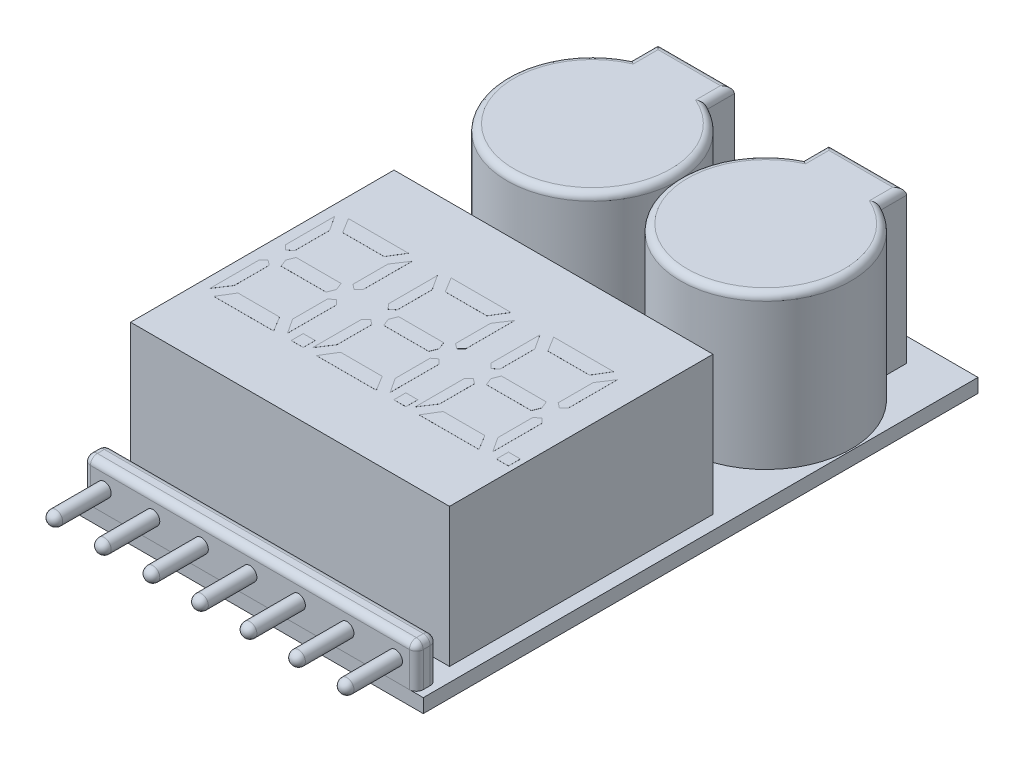
from build123d import *

# Parameters (mm, degrees)
IZIM1_W                  = 25
IZIM1_H                  = 40
EXTRUDED_BOSS_DEPTH      = 1
IZIM2_W                  = 24
IZIM2_H                  = 1.5
PIN_HEADER_DEPTH         = 3
IZIM3_R                  = 0.5
PINS_DEPTH               = 4
IZIM4_W                  = 23
IZIM4_H                  = 19
DISPLAY_DEPTH            = 10
BUZZER_DEPTH             = 11
FILLET_1_R               = 0.5
FILLET_2_R               = 0.5
DISPLAY_NUMBERS_DEPTH    = 0.005
DISPLAY_NUMBERS_2_DEPTH  = 0.005
DISPLAY_NUMBERS_3_DEPTH  = 0.005
IZIM8_W                  = 0.864
IZIM8_H                  = 0.864
DISPLAY_NUMBERS_4_DEPTH  = 0.005
DISPLAY_NUMBERS_5_DEPTH  = 0.005
DISPLAY_NUMBERS_6_DEPTH  = 0.005
DISPLAY_NUMBERS_7_DEPTH  = 0.005
DISPLAY_NUMBERS_8_DEPTH  = 0.005
DISPLAY_NUMBERS_9_DEPTH  = 0.005
DISPLAY_NUMBERS_10_DEPTH = 0.005
DISPLAY_NUMBERS_11_DEPTH = 0.005
DISPLAY_NUMBERS_12_DEPTH = 0.005
DISPLAY_NUMBERS_13_DEPTH = 0.005
DISPLAY_NUMBERS_14_DEPTH = 0.005
DISPLAY_NUMBERS_15_DEPTH = 0.005
DISPLAY_NUMBERS_16_DEPTH = 0.005
DISPLAY_NUMBERS_17_DEPTH = 0.005
DISPLAY_NUMBERS_18_DEPTH = 0.005
DISPLAY_NUMBERS_19_DEPTH = 0.005
DISPLAY_NUMBERS_20_DEPTH = 0.005
DISPLAY_NUMBERS_21_DEPTH = 0.005
DISPLAY_NUMBERS_22_DEPTH = 0.005
DISPLAY_NUMBERS_23_DEPTH = 0.005
DISPLAY_NUMBERS_24_DEPTH = 0.005
FILLET_3_R               = 0.5


with BuildPart() as part:
    # Çizim1 → extruded boss (new body)
    with BuildSketch(Plane(origin=(0, 0, 0), x_dir=(1, 0, 0), z_dir=(0, 1, 0))):
        Rectangle(IZIM1_W, IZIM1_H)
    extrude(amount=EXTRUDED_BOSS_DEPTH)

    # Çizim4 → display (add)
    with BuildSketch(Plane(origin=(0, 1, 0), x_dir=(1, 0, 0), z_dir=(0, 1, 0))):
        with Locations((0, -7.609299333)):
            Rectangle(IZIM4_W, IZIM4_H)
    extrude(amount=DISPLAY_DEPTH)

    # Çizim5 → buzzer (add)
    with BuildSketch(Plane(origin=(0, 1, 0), x_dir=(1, 0, 0), z_dir=(0, 1, 0))):
        with BuildLine():
            Line((3.448250256, 16.427727605), (3.448250256, 18.297718207))
            Line((3.448250256, 18.297718207), (9.051749744, 18.297718207))
            Line((9.051749744, 18.297718207), (9.051749744, 16.427727605))
            ThreePointArc((9.051749744, 16.427727605), (6.25, 4.788544167), (3.448250256, 16.427727605))
        make_face()
        with BuildLine():
            Line((-9, 16.453867572), (-9, 18.427827016))
            Line((-9, 18.427827016), (-3.5, 18.427827016))
            Line((-3.5, 18.427827016), (-3.5, 16.453867572))
            ThreePointArc((-3.5, 16.453867572), (-6.25, 4.788544167), (-9, 16.453867572))
        make_face()
    extrude(amount=BUZZER_DEPTH)

    # fillet 2
    fillet_2_edges = [part.edges().sort_by_distance(p)[0] for p in [
        (6.25, 12, -4.788544167),
        (9.051749744, 12, -17.362722906),
        (6.25, 12, -18.297718207),
        (3.448250256, 12, -17.362722906),
        (-6.25, 12, -4.788544167),
        (-3.5, 12, -17.440847294),
        (-6.25, 12, -18.427827016),
        (-9, 12, -17.440847294),
    ]]
    fillet(fillet_2_edges, radius=FILLET_2_R)


with BuildPart() as body_2:
    # Çizim2 → pin header (new body)
    with BuildSketch(Plane(origin=(0, 1, 0), x_dir=(1, 0, 0), z_dir=(0, 1, 0))):
        with Locations((0, -19.25)):
            Rectangle(IZIM2_W, IZIM2_H)
    extrude(amount=PIN_HEADER_DEPTH)

    # Çizim3 → pins (add)
    with BuildSketch(Plane.XY.offset(20)):
        with Locations(Location((0, 2.5, 0), (0, 0, 180))):
            Circle(IZIM3_R)
        with Locations(Location((3.5, 2.5, 0), (0, 0, 180))):
            Circle(IZIM3_R)
        with Locations(Location((7, 2.5, 0), (0, 0, 180))):
            Circle(IZIM3_R)
        with Locations(Location((10.5, 2.5, 0), (0, 0, 180))):
            Circle(IZIM3_R)
        with Locations(Location((-3.5, 2.5, 0), (0, 0, 180))):
            Circle(IZIM3_R)
        with Locations(Location((-7, 2.5, 0), (0, 0, 180))):
            Circle(IZIM3_R)
        with Locations(Location((-10.5, 2.5, 0), (0, 0, 180))):
            Circle(IZIM3_R)
    extrude(amount=PINS_DEPTH)

    # fillet 1
    fillet_1_edges = [body_2.edges().sort_by_distance(p)[0] for p in [
        (12, 4, 19.25),
        (0, 4, 18.5),
        (-12, 4, 19.25),
        (0, 4, 20),
        (-12, 2.5, 18.5),
        (12, 2.5, 18.5),
        (12, 2.5, 20),
        (-12, 2.5, 20),
    ]]
    fillet(fillet_1_edges, radius=FILLET_1_R)

    # fillet 3
    fillet_3_edges = [body_2.edges().sort_by_distance(p)[0] for p in [
        (0.5, 2.5, 24),
        (4, 2.5, 24),
        (7.5, 2.5, 24),
        (11, 2.5, 24),
        (-3, 2.5, 24),
        (-6.5, 2.5, 24),
        (-10, 2.5, 24),
    ]]
    fillet(fillet_3_edges, radius=FILLET_3_R)


with BuildPart() as body_3:
    # Çizim8 → display numbers (new body)
    with BuildSketch(Plane(origin=(0, 11, 0), x_dir=(1, 0, 0), z_dir=(0, 1, 0))):
        Polygon((-9.565923628, -7.102635228), (-6.325923628, -7.102635228), (-6.111966697, -7.642635228), (-6.325923628, -8.182635228), (-9.565923628, -8.182635228), (-9.77988056, -7.642635228), align=None)
    extrude(amount=DISPLAY_NUMBERS_DEPTH)


with BuildPart() as body_4:
    # Çizim8 → display numbers 2 (new body)
    with BuildSketch(Plane(origin=(0, 11, 0), x_dir=(1, 0, 0), z_dir=(0, 1, 0))):
        Polygon((-6.446228557, -11.4174762), (-9.445618699, -11.4174762), (-10.105923628, -12.4974762), (-5.785923628, -12.4974762), align=None)
    extrude(amount=DISPLAY_NUMBERS_2_DEPTH)


with BuildPart() as body_5:
    # Çizim8 → display numbers 3 (new body)
    with BuildSketch(Plane(origin=(0, 11, 0), x_dir=(1, 0, 0), z_dir=(0, 1, 0))):
        Polygon((-10.04799547, -11.079556724), (-10.742963358, -12.137584244), (-10.742963358, -8.607452765), (-10.417746487, -8.274597516), (-10.04799547, -8.558654673), align=None)
    extrude(amount=DISPLAY_NUMBERS_3_DEPTH)


with BuildPart() as body_6:
    # Çizim8 → display numbers 4 (new body)
    with BuildSketch(Plane(origin=(0, 11, 0), x_dir=(1, 0, 0), z_dir=(0, 1, 0))):
        with Locations((-4.127020396, -12.031325599)):
            Rectangle(IZIM8_W, IZIM8_H)
    extrude(amount=DISPLAY_NUMBERS_4_DEPTH)


with BuildPart() as body_7:
    # Çizim8 → display numbers 5 (new body)
    with BuildSketch(Plane(origin=(0, 11, 0), x_dir=(1, 0, 0), z_dir=(0, 1, 0))):
        Polygon((-5.47410077, -8.274597516), (-5.843851787, -8.558654673), (-5.843851787, -11.079556724), (-5.148883899, -12.137584244), (-5.148883899, -8.607452765), align=None)
    extrude(amount=DISPLAY_NUMBERS_5_DEPTH)


with BuildPart() as body_8:
    # Çizim8 → display numbers 6 (new body)
    with BuildSketch(Plane(origin=(0, 11, 0), x_dir=(1, 0, 0), z_dir=(0, 1, 0))):
        Polygon((-2.705923628, -12.4974762), (1.614076372, -12.4974762), (0.953771443, -11.4174762), (-2.045618699, -11.4174762), align=None)
    extrude(amount=DISPLAY_NUMBERS_6_DEPTH)


with BuildPart() as body_9:
    # Çizim8 → display numbers 7 (new body)
    with BuildSketch(Plane(origin=(0, 11, 0), x_dir=(1, 0, 0), z_dir=(0, 1, 0))):
        Polygon((-5.785923628, -2.787794256), (-10.105923628, -2.787794256), (-9.445618699, -3.867794256), (-6.446228557, -3.867794256), align=None)
    extrude(amount=DISPLAY_NUMBERS_7_DEPTH)


with BuildPart() as body_10:
    # Çizim8 → display numbers 8 (new body)
    with BuildSketch(Plane(origin=(0, 11, 0), x_dir=(1, 0, 0), z_dir=(0, 1, 0))):
        Polygon((4.694076372, -12.4974762), (9.014076372, -12.4974762), (8.353771443, -11.4174762), (5.354381301, -11.4174762), align=None)
    extrude(amount=DISPLAY_NUMBERS_8_DEPTH)


with BuildPart() as body_11:
    # Çizim8 → display numbers 9 (new body)
    with BuildSketch(Plane(origin=(0, 11, 0), x_dir=(1, 0, 0), z_dir=(0, 1, 0))):
        Polygon((-5.843851787, -4.205713732), (-5.148883899, -3.147686212), (-5.148883899, -6.677817691), (-5.47410077, -7.01067294), (-5.843851787, -6.726615783), align=None)
    extrude(amount=DISPLAY_NUMBERS_9_DEPTH)


with BuildPart() as body_12:
    # Çizim8 → display numbers 10 (new body)
    with BuildSketch(Plane(origin=(0, 11, 0), x_dir=(1, 0, 0), z_dir=(0, 1, 0))):
        Polygon((5.234076372, -8.182635228), (8.474076372, -8.182635228), (8.688033303, -7.642635228), (8.474076372, -7.102635228), (5.234076372, -7.102635228), (5.02011944, -7.642635228), align=None)
    extrude(amount=DISPLAY_NUMBERS_10_DEPTH)


with BuildPart() as body_13:
    # Çizim8 → display numbers 11 (new body)
    with BuildSketch(Plane(origin=(0, 11, 0), x_dir=(1, 0, 0), z_dir=(0, 1, 0))):
        Polygon((-10.417746487, -7.01067294), (-10.04799547, -6.726615783), (-10.04799547, -4.205713732), (-10.742963358, -3.147686212), (-10.742963358, -6.677817691), align=None)
    extrude(amount=DISPLAY_NUMBERS_11_DEPTH)


with BuildPart() as body_14:
    # Çizim8 → display numbers 12 (new body)
    with BuildSketch(Plane(origin=(0, 11, 0), x_dir=(1, 0, 0), z_dir=(0, 1, 0))):
        Polygon((-2.64799547, -11.079556724), (-3.342963358, -12.137584244), (-3.342963358, -8.607452765), (-3.017746487, -8.274597516), (-2.64799547, -8.558654673), align=None)
    extrude(amount=DISPLAY_NUMBERS_12_DEPTH)


with BuildPart() as body_15:
    # Çizim8 → display numbers 13 (new body)
    with BuildSketch(Plane(origin=(0, 11, 0), x_dir=(1, 0, 0), z_dir=(0, 1, 0))):
        Polygon((1.074076372, -8.182635228), (-2.165923628, -8.182635228), (-2.37988056, -7.642635228), (-2.165923628, -7.102635228), (1.074076372, -7.102635228), (1.288033303, -7.642635228), align=None)
    extrude(amount=DISPLAY_NUMBERS_13_DEPTH)


with BuildPart() as body_16:
    # Çizim8 → display numbers 14 (new body)
    with BuildSketch(Plane(origin=(0, 11, 0), x_dir=(1, 0, 0), z_dir=(0, 1, 0))):
        with Locations((3.272979604, -12.031325599)):
            Rectangle(IZIM8_W, IZIM8_H)
    extrude(amount=DISPLAY_NUMBERS_14_DEPTH)


with BuildPart() as body_17:
    # Çizim8 → display numbers 15 (new body)
    with BuildSketch(Plane(origin=(0, 11, 0), x_dir=(1, 0, 0), z_dir=(0, 1, 0))):
        Polygon((1.92589923, -8.274597516), (1.556148213, -8.558654673), (1.556148213, -11.079556724), (2.251116101, -12.137584244), (2.251116101, -8.607452765), align=None)
    extrude(amount=DISPLAY_NUMBERS_15_DEPTH)


with BuildPart() as body_18:
    # Çizim8 → display numbers 16 (new body)
    with BuildSketch(Plane(origin=(0, 11, 0), x_dir=(1, 0, 0), z_dir=(0, 1, 0))):
        Polygon((1.614076372, -2.787794256), (-2.705923628, -2.787794256), (-2.045618699, -3.867794256), (0.953771443, -3.867794256), align=None)
    extrude(amount=DISPLAY_NUMBERS_16_DEPTH)


with BuildPart() as body_19:
    # Çizim8 → display numbers 17 (new body)
    with BuildSketch(Plane(origin=(0, 11, 0), x_dir=(1, 0, 0), z_dir=(0, 1, 0))):
        Polygon((1.556148213, -4.205713732), (2.251116101, -3.147686212), (2.251116101, -6.677817691), (1.92589923, -7.01067294), (1.556148213, -6.726615783), align=None)
    extrude(amount=DISPLAY_NUMBERS_17_DEPTH)


with BuildPart() as body_20:
    # Çizim8 → display numbers 18 (new body)
    with BuildSketch(Plane(origin=(0, 11, 0), x_dir=(1, 0, 0), z_dir=(0, 1, 0))):
        Polygon((-3.017746487, -7.01067294), (-2.64799547, -6.726615783), (-2.64799547, -4.205713732), (-3.342963358, -3.147686212), (-3.342963358, -6.677817691), align=None)
    extrude(amount=DISPLAY_NUMBERS_18_DEPTH)


with BuildPart() as body_21:
    # Çizim8 → display numbers 19 (new body)
    with BuildSketch(Plane(origin=(0, 11, 0), x_dir=(1, 0, 0), z_dir=(0, 1, 0))):
        Polygon((4.75200453, -11.079556724), (4.057036642, -12.137584244), (4.057036642, -8.607452765), (4.382253513, -8.274597516), (4.75200453, -8.558654673), align=None)
    extrude(amount=DISPLAY_NUMBERS_19_DEPTH)


with BuildPart() as body_22:
    # Çizim8 → display numbers 20 (new body)
    with BuildSketch(Plane(origin=(0, 11, 0), x_dir=(1, 0, 0), z_dir=(0, 1, 0))):
        with Locations((10.672979604, -12.031325599)):
            Rectangle(IZIM8_W, IZIM8_H)
    extrude(amount=DISPLAY_NUMBERS_20_DEPTH)


with BuildPart() as body_23:
    # Çizim8 → display numbers 21 (new body)
    with BuildSketch(Plane(origin=(0, 11, 0), x_dir=(1, 0, 0), z_dir=(0, 1, 0))):
        Polygon((9.32589923, -8.274597516), (8.956148213, -8.558654673), (8.956148213, -11.079556724), (9.651116101, -12.137584244), (9.651116101, -8.607452765), align=None)
    extrude(amount=DISPLAY_NUMBERS_21_DEPTH)


with BuildPart() as body_24:
    # Çizim8 → display numbers 22 (new body)
    with BuildSketch(Plane(origin=(0, 11, 0), x_dir=(1, 0, 0), z_dir=(0, 1, 0))):
        Polygon((9.014076372, -2.787794256), (4.694076372, -2.787794256), (5.354381301, -3.867794256), (8.353771443, -3.867794256), align=None)
    extrude(amount=DISPLAY_NUMBERS_22_DEPTH)


with BuildPart() as body_25:
    # Çizim8 → display numbers 23 (new body)
    with BuildSketch(Plane(origin=(0, 11, 0), x_dir=(1, 0, 0), z_dir=(0, 1, 0))):
        Polygon((8.956148213, -4.205713732), (9.651116101, -3.147686212), (9.651116101, -6.677817691), (9.32589923, -7.01067294), (8.956148213, -6.726615783), align=None)
    extrude(amount=DISPLAY_NUMBERS_23_DEPTH)


with BuildPart() as body_26:
    # Çizim8 → display numbers 24 (new body)
    with BuildSketch(Plane(origin=(0, 11, 0), x_dir=(1, 0, 0), z_dir=(0, 1, 0))):
        Polygon((4.382253513, -7.01067294), (4.75200453, -6.726615783), (4.75200453, -4.205713732), (4.057036642, -3.147686212), (4.057036642, -6.677817691), align=None)
    extrude(amount=DISPLAY_NUMBERS_24_DEPTH)


solid = Compound([part.part, body_2.part, body_3.part, body_4.part, body_5.part, body_6.part, body_7.part, body_8.part, body_9.part, body_10.part, body_11.part, body_12.part, body_13.part, body_14.part, body_15.part, body_16.part, body_17.part, body_18.part, body_19.part, body_20.part, body_21.part, body_22.part, body_23.part, body_24.part, body_25.part, body_26.part])
